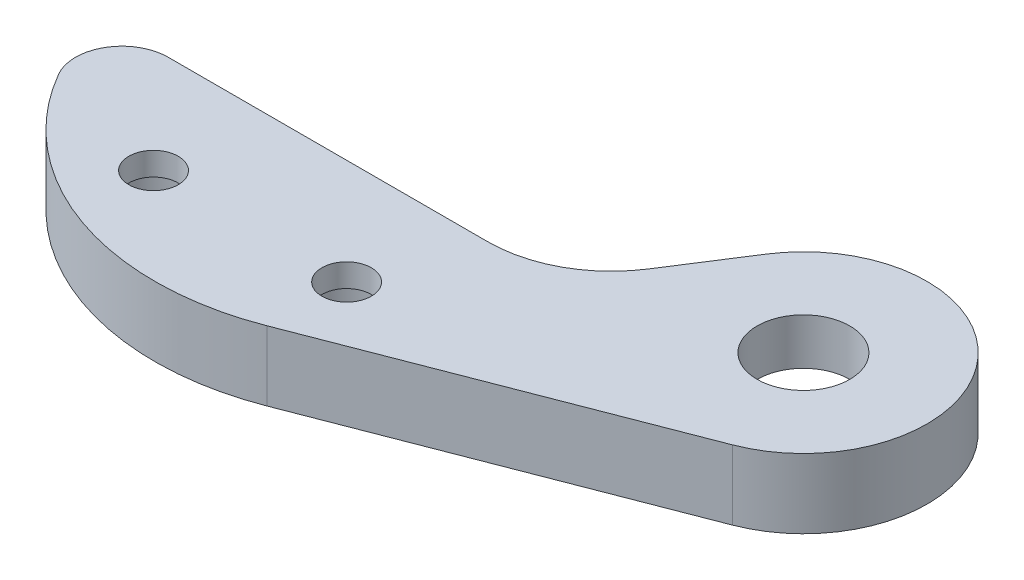
from build123d import *

# Parameters (mm, degrees)
EXTRUDE_1_DEPTH             = 4.5
HOLE_WIZARD_M31_D           = 3.2
HOLE_WIZARD_M31_CBORE_D     = 6.05
HOLE_WIZARD_M31_CBORE_DEPTH = 3
HOLE_WIZARD_1_D             = 6
HOLE_WIZARD_1_CBORE_D       = 10.5
HOLE_WIZARD_1_CBORE_DEPTH   = 1.5
FILLET_1_R                  = 8


with BuildPart() as part:
    # Эскиз1 → Бобышка-Вытянуть1 (new body)
    with BuildSketch(Plane.XZ):
        with BuildLine():
            Line((-12.124355653, 4), (12.936430666, 4))
            Line((12.936430666, 4), (18.263831879, -4.315557791))
            ThreePointArc((18.263831879, -4.315557791), (31.197157109, -5.059174218), (27.88, 7.463618425))
            Line((27.88, 7.463618425), (6.12, 15.860189154))
            ThreePointArc((6.12, 15.860189154), (-5.660702659, 16.029861054), (-14.722431864, 8.5))
            ThreePointArc((-14.722431864, 8.5), (-14.722431864, 5.5), (-12.124355653, 4))
        make_face()
    extrude(amount=-EXTRUDE_1_DEPTH)

    # Цековка для винта с заклепочной головкой M31 (through all)
    with Locations(Plane(origin=(0, 4.5, 0), x_dir=(1, 0, 0), z_dir=(0, 1, 0))):
        with Locations((-6.25, -10.825317547), (6.25, -10.825317547)):
            CounterBoreHole(HOLE_WIZARD_M31_D / 2, HOLE_WIZARD_M31_CBORE_D / 2, HOLE_WIZARD_M31_CBORE_DEPTH)

    # Отверстие1 (through all)
    with Locations(Plane(origin=(0, 4.5, 0), x_dir=(1, 0, 0), z_dir=(0, 1, 0))):
        with Locations((25, 0)):
            CounterBoreHole(HOLE_WIZARD_1_D / 2, HOLE_WIZARD_1_CBORE_D / 2, HOLE_WIZARD_1_CBORE_DEPTH)

    # Скругление1
    fillet_1_edges = [part.edges().sort_by_distance(p)[0] for p in [
        (12.936430666, 2.25, 4),
    ]]
    fillet(fillet_1_edges, radius=FILLET_1_R)


with BuildPart() as body_2:
    # Зеркальное отражение1: mirrored copy
    add(part.part.mirror(Plane(origin=(0, 0, 0), x_dir=(0, 0, 1), z_dir=(0, -1, 0))))


solid = body_2.part
